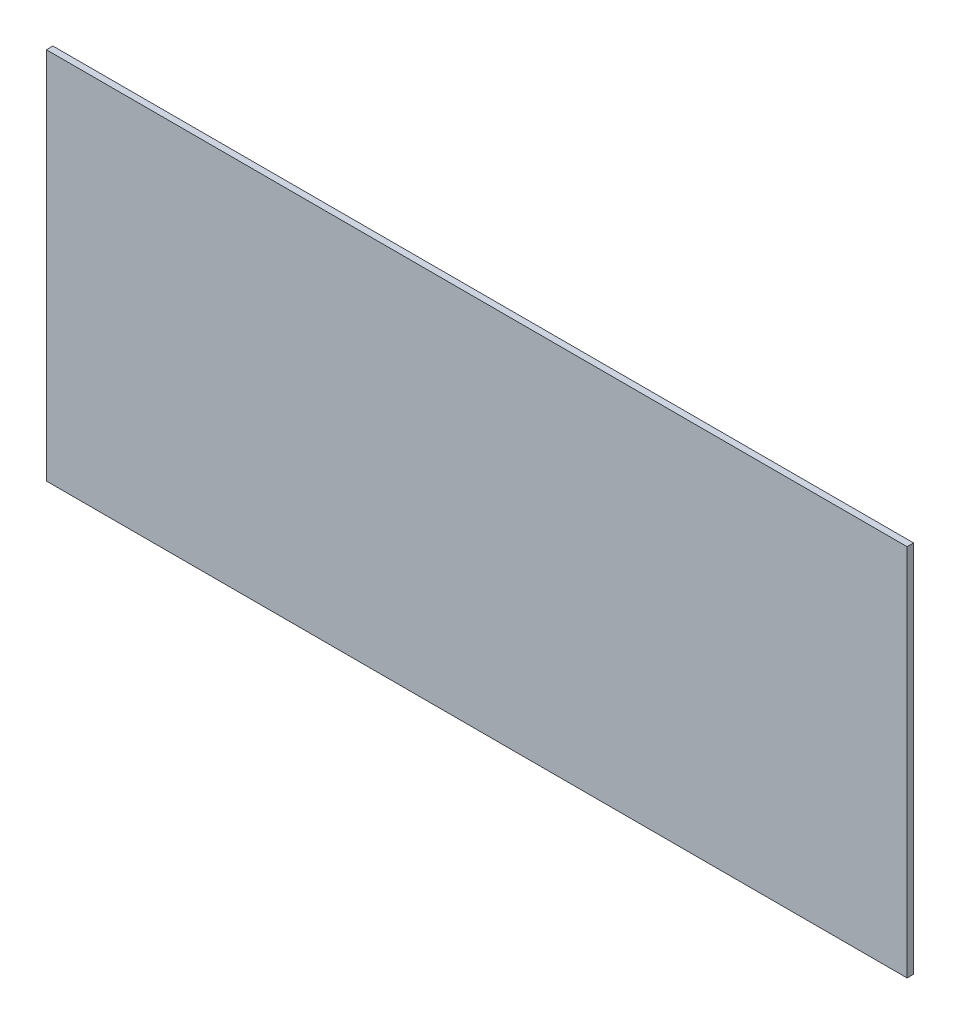
from build123d import *

# Parameters (mm, degrees)
CROQUIS1_W              = 530
CROQUIS1_H              = 230
SALIENTE_EXTRUIR1_DEPTH = 4


with BuildPart() as part:
    # Croquis1 → Saliente-Extruir1 (new body)
    with BuildSketch(Plane.XY):
        Rectangle(CROQUIS1_W, CROQUIS1_H)
    extrude(amount=SALIENTE_EXTRUIR1_DEPTH)


solid = part.part
